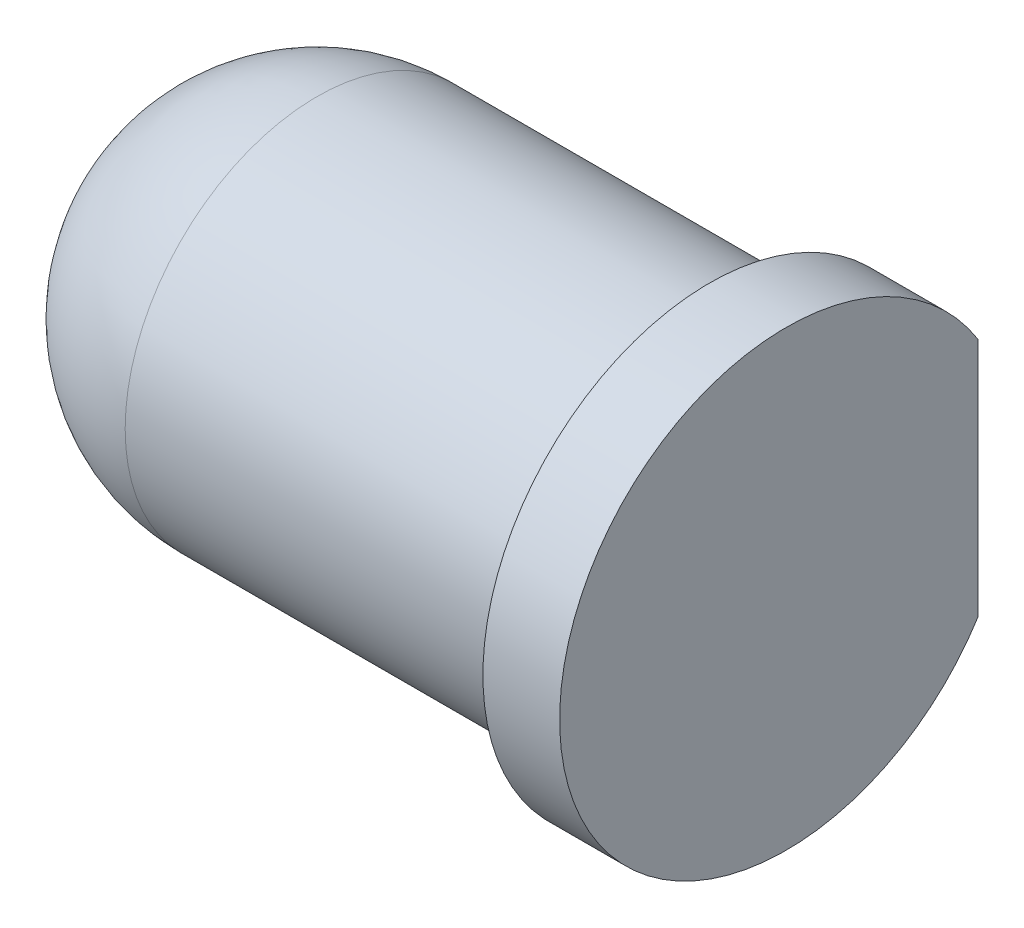
from build123d import *

# Parameters (mm, degrees)
SKETCH2_R           = 2.5
BOSS_EXTRUDE1_DEPTH = 3.8
SKETCH3_R           = 2.95
BOSS_EXTRUDE3_DEPTH = 1
SKETCH4_W           = 0.865778577
SKETCH4_H           = 6.939291368
CUT_EXTRUDE1_DEPTH  = 1


with BuildPart() as part:
    # Sketch2 → Boss-Extrude1 (new, symmetric)
    with BuildSketch(Plane(origin=(0, 0, 0), x_dir=(0, 0, -1), z_dir=(1, 0, 0))):
        with Locations(Location((0, 0, 0), (0, 0, 180))):
            Circle(SKETCH2_R)
    extrude(amount=BOSS_EXTRUDE1_DEPTH, both=True)

    # Sketch3 → Boss-Extrude3 (add)
    with BuildSketch(Plane(origin=(3.8, 0, 0), x_dir=(0, 0, -1), z_dir=(1, 0, 0))):
        Circle(SKETCH3_R)
    extrude(amount=BOSS_EXTRUDE3_DEPTH)

    # Sketch4 → Cut-Extrude1 (cut)
    with BuildSketch(Plane.ZY.offset(-3.8)):
        with Locations((-2.932889289, -0.568577956)):
            Rectangle(SKETCH4_W, SKETCH4_H)
    extrude(amount=-CUT_EXTRUDE1_DEPTH, mode=Mode.SUBTRACT)

    # Sketch5 → Cut-Revolve4 (revolve, cut)
    with BuildSketch(Plane(origin=(0, 0, 0), x_dir=(1, 0, 0), z_dir=(0, 1, 0))):
        with BuildLine():
            Line((-3.8, -0.01), (-3.8, -2.5))
            Line((-3.8, -2.5), (-1.31, -2.5))
            ThreePointArc((-1.31, -2.5), (-3.070695885, -1.770695885), (-3.8, -0.01))
        make_face()
    revolve(axis=Axis((-4.317331634, 0, 0), (1, 0, 0)), mode=Mode.SUBTRACT)


solid = part.part
